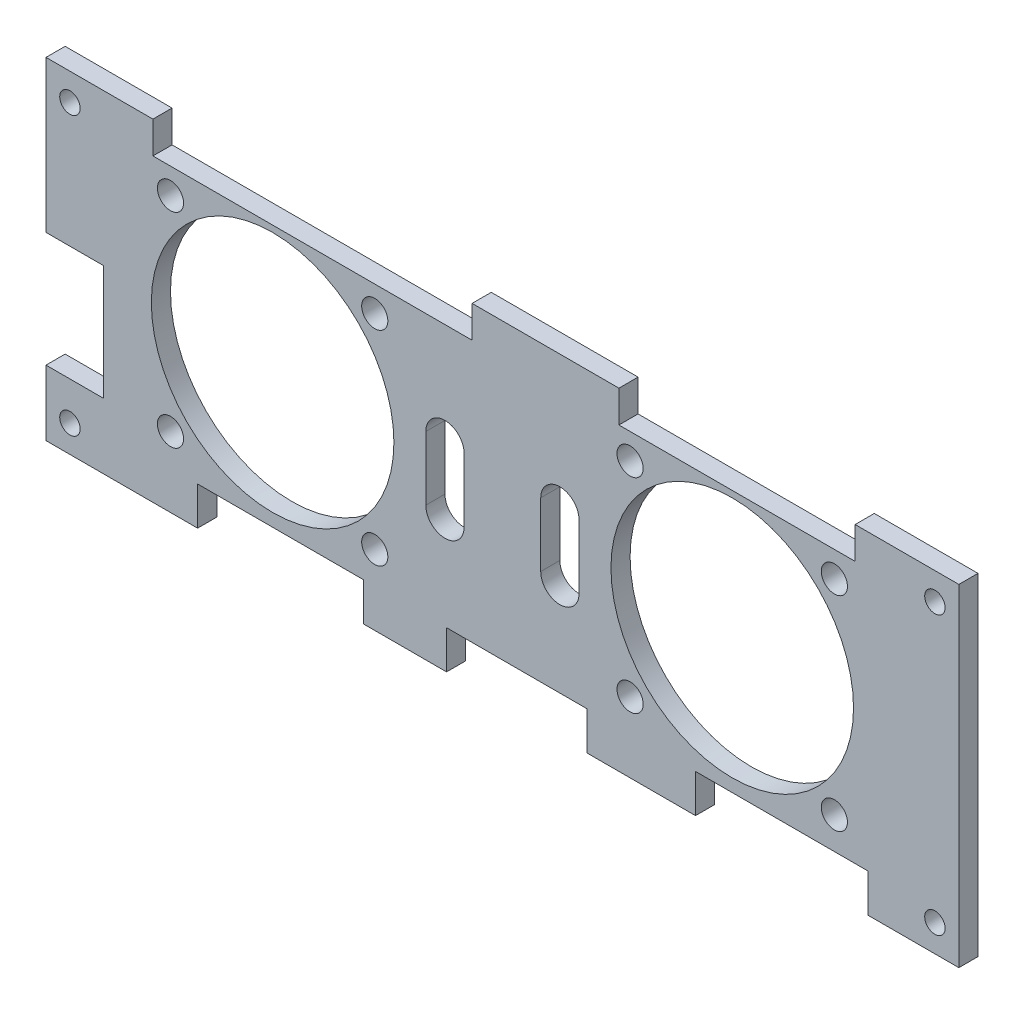
from build123d import *

# Parameters (mm, degrees)
SKETCH1_W               = 143
SKETCH1_H               = 52
SKETCH1_R               = 1.6
BOSS_EXTRUDE1_DEPTH     = 3
CUT_EXTRUDE1_DEPTH      = 77.139674284
CUT_EXTRUDE1_DEPTH_BACK = 10
SKETCH2_W               = 26
SKETCH2_H               = 6
SKETCH2_W_2             = 22
SKETCH2_W_3             = 27
SKETCH2_W_4             = 9
SKETCH2_H_2             = 18
SKETCH4_W               = 50
SKETCH4_H               = 5
SKETCH4_W_2             = 37
CUT_EXTRUDE2_DEPTH      = 3
SKETCH5_R               = 2.05
SKETCH5_R_2             = 19
CUT_EXTRUDE3_DEPTH      = 3
CUT_EXTRUDE4_DEPTH      = 3


with BuildPart() as part:
    # Sketch1 → Boss-Extrude1 (new body)
    with BuildSketch(Plane.XY):
        Rectangle(SKETCH1_W, SKETCH1_H)
        with Locations((-67.75, 21.75)):
            Circle(SKETCH1_R, mode=Mode.SUBTRACT)
        with Locations((-67.75, -21.75)):
            Circle(SKETCH1_R, mode=Mode.SUBTRACT)
        with Locations((67.75, 21.75)):
            Circle(SKETCH1_R, mode=Mode.SUBTRACT)
        with Locations((67.75, -21.75)):
            Circle(SKETCH1_R, mode=Mode.SUBTRACT)
    extrude(amount=BOSS_EXTRUDE1_DEPTH)

    # Sketch2 → Cut-Extrude1 (cut, two sides: drawn at the far end of the back side and taken through both)
    with BuildSketch(Plane.XY.offset(3).offset(-CUT_EXTRUDE1_DEPTH_BACK)):
        with Locations((-34.75, -23)):
            Rectangle(SKETCH2_W, SKETCH2_H)
        with Locations((2.25, -23)):
            Rectangle(SKETCH2_W_2, SKETCH2_H)
        with Locations((43.75, -23)):
            Rectangle(SKETCH2_W_3, SKETCH2_H)
        with Locations((-67, -6.75)):
            Rectangle(SKETCH2_W_4, SKETCH2_H_2)
    extrude(amount=CUT_EXTRUDE1_DEPTH + CUT_EXTRUDE1_DEPTH_BACK, mode=Mode.SUBTRACT)

    # Sketch4 → Cut-Extrude2 (cut)
    with BuildSketch(Plane.XY.offset(3)):
        with Locations((-29.75, 23.5)):
            Rectangle(SKETCH4_W, SKETCH4_H)
        with Locations((36.75, 23.5)):
            Rectangle(SKETCH4_W_2, SKETCH4_H)
    extrude(amount=-CUT_EXTRUDE2_DEPTH, mode=Mode.SUBTRACT)

    # Sketch5 → Cut-Extrude3 (cut)
    with BuildSketch(Plane.XY.offset(3)):
        with Locations((52, -15)):
            Circle(SKETCH5_R)
        with Locations((20, -15)):
            Circle(SKETCH5_R)
        with Locations((20, 17)):
            Circle(SKETCH5_R)
        with Locations((52, 17)):
            Circle(SKETCH5_R)
        with Locations((36, 1)):
            Circle(SKETCH5_R_2)
    cut_extrude3 = extrude(amount=-CUT_EXTRUDE3_DEPTH, mode=Mode.SUBTRACT)

    # Mirror1: Cut-Extrude3 across plane
    add(cut_extrude3.mirror(Plane(origin=(0, 0, 0), x_dir=(0, 0, 1), z_dir=(1, 0, 0))), mode=Mode.SUBTRACT)

    # Sketch6 → Cut-Extrude4 (cut)
    with BuildSketch(Plane.XY.offset(3)):
        with BuildLine():
            Line((6, -5), (6, 5))
            ThreePointArc((6, 5), (9, 8), (12, 5))
            Line((12, 5), (12, -5))
            ThreePointArc((12, -5), (9, -8), (6, -5))
        make_face()
        with BuildLine():
            Line((-6, -5), (-6, 5))
            ThreePointArc((-6, 5), (-9, 8), (-12, 5))
            Line((-12, 5), (-12, -5))
            ThreePointArc((-12, -5), (-9, -8), (-6, -5))
        make_face()
    extrude(amount=-CUT_EXTRUDE4_DEPTH, mode=Mode.SUBTRACT)


solid = part.part
